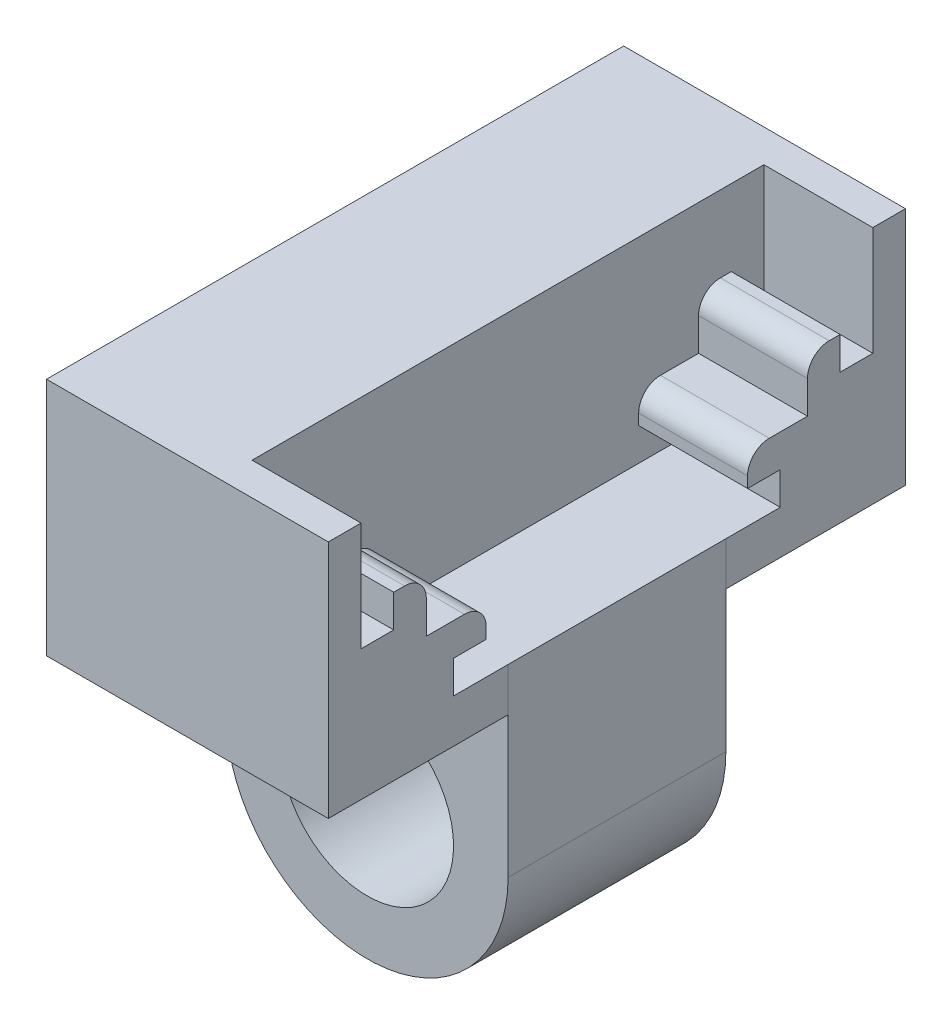
from build123d import *

# Parameters (mm, degrees)
BOSS_EXTRUDE1_DEPTH = 10
FILLET1_R           = 2
SKETCH2_W           = 26.5
SKETCH2_H           = 22
BOSS_EXTRUDE2_DEPTH = 15.88
SKETCH3_R           = 7.9375
BOSS_EXTRUDE3_DEPTH = 10


with BuildPart() as part:
    # Sketch1 → Boss-Extrude1 (new body)
    with BuildSketch(Plane(origin=(0, 0, 0), x_dir=(0, 0, -1), z_dir=(1, 0, 0))):
        Polygon((-26.5, -27.5), (-26.5, -5.5), (-23.5, -5.5), (-23.5, -15.5), (-20.5, -15.5), (-20.5, -12.5), (-17.5, -12.5), (-17.5, -17.5), (-12, -17.5), (-12, -20.5), (-15, -20.5), (-15, -23.5), (0, -23.5), (0, -27.5), align=None)
    extrude(amount=BOSS_EXTRUDE1_DEPTH)

    # Fillet1
    fillet1_edges = [part.edges().sort_by_distance(p)[0] for p in [
        (5, -12.5, 17.5),
        (5, -17.5, 12),
    ]]
    fillet(fillet1_edges, radius=FILLET1_R)

    # Sketch2 → Boss-Extrude2 (add)
    with BuildSketch(Plane.ZY):
        with Locations((13.25, -16.5)):
            Rectangle(SKETCH2_W, SKETCH2_H)
    extrude(amount=BOSS_EXTRUDE2_DEPTH)

    # Sketch3 → Boss-Extrude3 (add)
    with BuildSketch(Plane(origin=(0, 0, 0), x_dir=(-1, 0, 0), z_dir=(0, 0, -1))):
        with BuildLine():
            Line((-10.00567497, -40.433161955), (-10, -23.5))
            Line((-10, -23.5), (15.88, -23.5))
            Line((15.88, -23.5), (15.882323576, -40.433162744))
            ThreePointArc((15.882323576, -40.433162744), (2.938323909, -53.3815), (-10.00567497, -40.433161955))
        make_face()
        with Locations(Location((2.938324303, -40.4375, 0), (0, 0, 90))):
            Circle(SKETCH3_R, mode=Mode.SUBTRACT)
    extrude(amount=-BOSS_EXTRUDE3_DEPTH)

    # Mirror1: part across plane


with BuildPart() as part_1:
    add(part.part)
    add(part.part.mirror(Plane(origin=(10, -23.5, 0), x_dir=(1, 0, 0), z_dir=(0, 0, 1))))


solid = part_1.part
